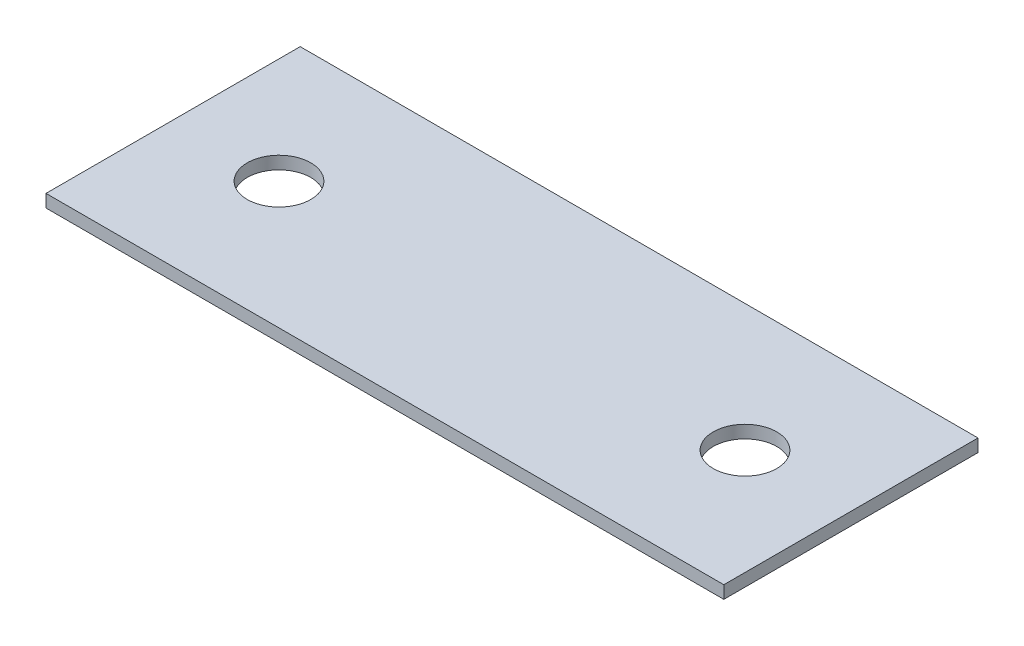
from build123d import *

# Parameters (mm, degrees)
SKETCH1_W           = 160
SKETCH1_H           = 60
SKETCH1_R           = 7.5
BOSS_EXTRUDE1_DEPTH = 3


with BuildPart() as part:
    # Sketch1 → Boss-Extrude1 (new body)
    with BuildSketch(Plane(origin=(0, 0, 0), x_dir=(1, 0, 0), z_dir=(0, 1, 0))):
        Rectangle(SKETCH1_W, SKETCH1_H)
        with Locations(Location((55, 0, 0), (0, 0, 270))):
            Circle(SKETCH1_R, mode=Mode.SUBTRACT)
        with Locations(Location((-55, 0, 0), (0, 0, 270))):
            Circle(SKETCH1_R, mode=Mode.SUBTRACT)
    extrude(amount=BOSS_EXTRUDE1_DEPTH)


solid = part.part
